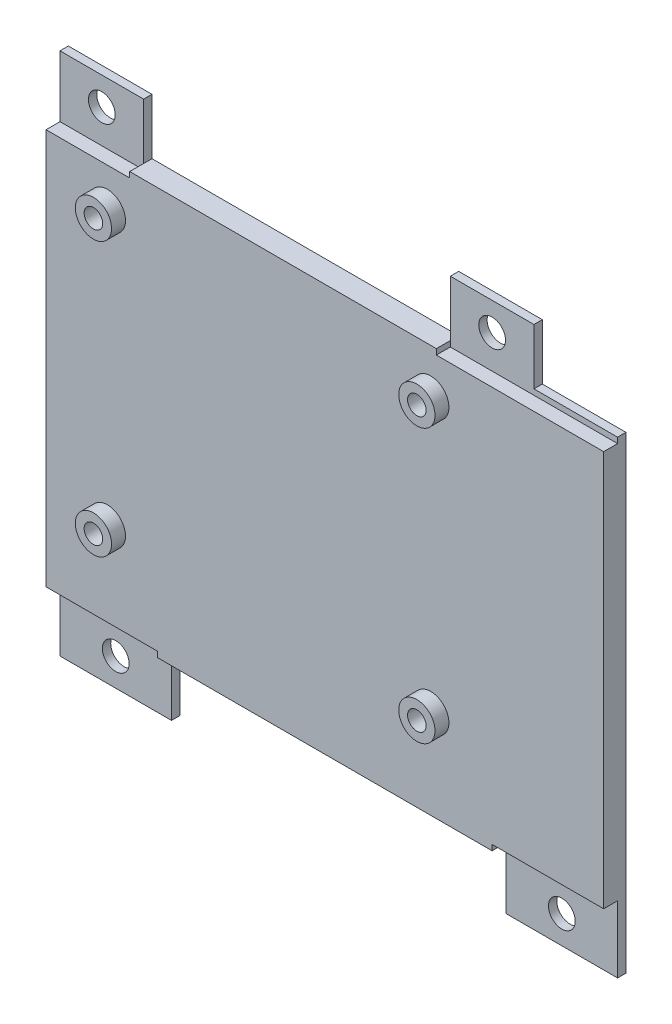
from build123d import *

# Parameters (mm, degrees)
SKETCH1_W            = 100
SKETCH1_H            = 65
BOSS_EXTRUDE1_DEPTH  = 1.5
SKETCH2_R            = 3.25
SKETCH2_R_2          = 1.665
BOSS_EXTRUDE2_DEPTH  = 5
SKETCH4_W            = 15
SKETCH4_H            = 10
BOSS_EXTRUDE3_DEPTH  = 1.5
M4_CLEARANCE_HOLE1_D = 4.8
SKETCH8_R            = 3.25
SKETCH8_W            = 55
SKETCH8_H            = 1
SKETCH8_W_2          = 60
BOSS_EXTRUDE4_DEPTH  = 2.5


with BuildPart() as part:
    # Sketch1 → Boss-Extrude1 (new body)
    with BuildSketch(Plane.XY):
        Rectangle(SKETCH1_W, SKETCH1_H)
    extrude(amount=BOSS_EXTRUDE1_DEPTH)

    # Sketch2 → Boss-Extrude2 (add)
    # profile 1 of 4: a face of its own
    with BuildSketch(Plane.XY.offset(1.5)):
        with Locations((-39, 24.5)):
            Circle(SKETCH2_R)
        with Locations((-39, 24.5)):
            Circle(SKETCH2_R_2, mode=Mode.SUBTRACT)
    # profile 2 of 4: a face of its own
    with BuildSketch(Plane.XY.offset(1.5)):
        with Locations((19, 24.5)):
            Circle(SKETCH2_R)
        with Locations((19, 24.5)):
            Circle(SKETCH2_R_2, mode=Mode.SUBTRACT)
    # profile 3 of 4: a face of its own
    with BuildSketch(Plane.XY.offset(1.5)):
        with Locations((19, -24.5)):
            Circle(SKETCH2_R)
        with Locations((19, -24.5)):
            Circle(SKETCH2_R_2, mode=Mode.SUBTRACT)
    # profile 4 of 4: a face of its own
    with BuildSketch(Plane.XY.offset(1.5)):
        with Locations((-39, -24.5)):
            Circle(SKETCH2_R)
        with Locations((-39, -24.5)):
            Circle(SKETCH2_R_2, mode=Mode.SUBTRACT)
    extrude(amount=BOSS_EXTRUDE2_DEPTH)

    # Sketch4 → Boss-Extrude3 (add)
    with BuildSketch(Plane(origin=(0, 0, 0), x_dir=(-1, 0, 0), z_dir=(0, 0, -1))):
        Polygon((-50, -32.5), (-50, -51.5), (-30, -51.5), (-30, -40.5), (30, -40.5), (30, -51.5), (50, -51.5), (50, -32.5), align=None)
        with Locations((-27.5, 37.5)):
            Rectangle(SKETCH4_W, SKETCH4_H)
        with Locations((42.5, 37.5)):
            Rectangle(SKETCH4_W, SKETCH4_H)
    extrude(amount=-BOSS_EXTRUDE3_DEPTH)

    # M4 Clearance Hole1 (through all)
    with Locations(Plane(origin=(0, 0, 0), x_dir=(-1, 0, 0), z_dir=(0, 0, -1))):
        with Locations((-40, -46.5), (40, -46.5), (42.5, 37.5), (-27.5, 37.5)):
            Hole(M4_CLEARANCE_HOLE1_D / 2)

    # Sketch8 → Boss-Extrude4 (add)
    # profile 1 of 3: a face of its own
    with BuildSketch(Plane.XY.offset(1.5)):
        Polygon((-35, 31.5), (-50, 31.5), (-50, -39.5), (-30, -39.5), (30, -39.5), (50, -39.5), (50, 31.5), (35, 31.5), (20, 31.5), align=None)
        with Locations((-39, -24.5)):
            Circle(SKETCH8_R, mode=Mode.SUBTRACT)
        with Locations((19, -24.5)):
            Circle(SKETCH8_R, mode=Mode.SUBTRACT)
        with Locations((-39, 24.5)):
            Circle(SKETCH8_R, mode=Mode.SUBTRACT)
        with Locations((19, 24.5)):
            Circle(SKETCH8_R, mode=Mode.SUBTRACT)
    # profile 2 of 3: a face of its own
    with BuildSketch(Plane.XY.offset(1.5)):
        with Locations((-7.5, 32)):
            Rectangle(SKETCH8_W, SKETCH8_H)
    # profile 3 of 3: a face of its own
    with BuildSketch(Plane.XY.offset(1.5)):
        with Locations((0, -40)):
            Rectangle(SKETCH8_W_2, SKETCH8_H)
    extrude(amount=BOSS_EXTRUDE4_DEPTH)


solid = part.part
